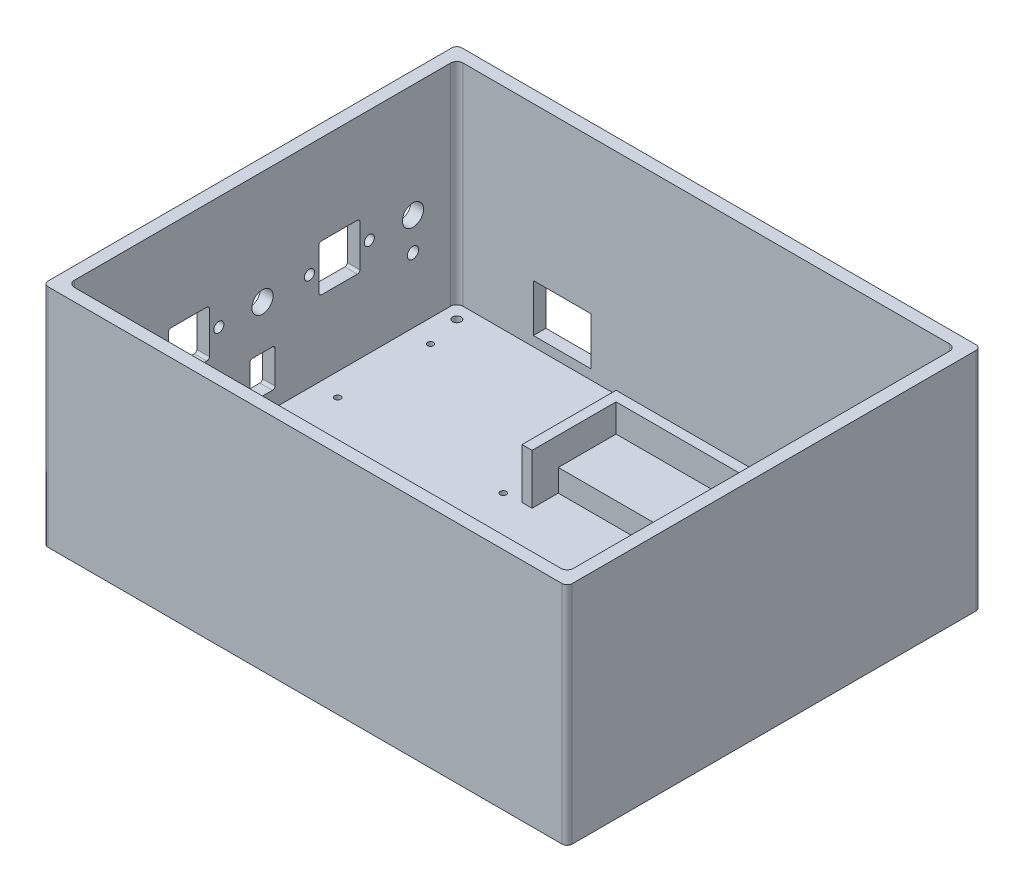
from build123d import *

# Parameters (mm, degrees)
CROQUIS1_W                                           = 209
CROQUIS1_H                                           = 165
SALIENTE_EXTRUIR1_DEPTH                              = 6
SALIENTE_EXTRUIR2_DEPTH                              = 20
CROQUIS5_W                                           = 110
CROQUIS5_H                                           = 23.048861143
SALIENTE_EXTRUIR3_DEPTH                              = 8.865038464
CROQUIS6_W                                           = 209
CROQUIS6_H                                           = 165
CROQUIS6_W_2                                         = 199
CROQUIS6_H_2                                         = 155
SALIENTE_EXTRUIR4_DEPTH                              = 84
CORTAR_EXTRUIR2_REACH                                = 359.208
CROQUIS8_W                                           = 23
CROQUIS8_H                                           = 19
CORTAR_EXTRUIR4_REACH                                = 254.595
CROQUIS10_R                                          = 1.25
CROQUIS10_W                                          = 10
CROQUIS10_H                                          = 15
CROQUIS9_R                                           = 2
CROQUIS9_W                                           = 16.35
CROQUIS9_H                                           = 18.6
CORTAR_EXTRUIR5_DEPTH                                = 10
AVELLANADO_PARA_TORNILLO_CON_CABEZA_PLAN_D           = 2.4
AVELLANADO_PARA_TORNILLO_CON_CABEZA_PLAN_CSINK_D     = 4.4
AVELLANADO_PARA_TORNILLO_CON_CABEZA_PLAN_CSINK_ANGLE = 90
REDONDEO1_R                                          = 2
REDONDEO2_R                                          = 2.5
MATRIZL2_COUNT                                       = 2
MATRIZL2_PITCH                                       = 60
MATRIZL3_COUNT                                       = 2
MATRIZL3_PITCH                                       = 60
CORTAR_EXTRUIR6_DEPTH                                = 10
REFRENTADO_PARA_TORNILLO_TAP_N_CON_CABEZ_D           = 3.4
REFRENTADO_PARA_TORNILLO_TAP_N_CON_CABEZ_DEPTH       = 8.2
REFRENTADO_PARA_TORNILLO_TAP_N_CON_CABEZ_CSINK_D     = 6.72
REFRENTADO_PARA_TORNILLO_TAP_N_CON_CABEZ_CSINK_ANGLE = 90
REFRENTADO_PARA_TORNILLO_TAP_N_CON_CABEZ_TIP         = 1.021463052
CORTAR_EXTRUIR7_REACH                                = 254.595
CROQUIS24_R                                          = 2.25
REDONDEO3_R                                          = 1


with BuildPart() as part:
    # Croquis1 → Saliente-Extruir1 (new body)
    with BuildSketch(Plane(origin=(40.752081892, -109.4, 0), x_dir=(-1, 0, 0), z_dir=(0, -1, 0))):
        with Locations((-149.8, 0)):
            Rectangle(CROQUIS1_W, CROQUIS1_H)
    extrude(amount=SALIENTE_EXTRUIR1_DEPTH)

    # Croquis3 → Saliente-Extruir2 (add)
    with BuildSketch(Plane(origin=(0, -109.4, 0), x_dir=(1, 0, 0), z_dir=(0, 1, 0))):
        Polygon((177.052081892, -55), (177.052081892, -21.5), (173.052081892, -21.5), (173.052081892, -59), (291.052081892, -59), (291.052081892, 59), (173.052081892, 59), (173.052081892, 21.5), (177.052081892, 21.5), (177.052081892, 55), (287.052081892, 55), (287.052081892, -55), align=None)
    extrude(amount=SALIENTE_EXTRUIR2_DEPTH)

    # Croquis5 → Saliente-Extruir3 (add)
    with BuildSketch(Plane(origin=(0, -109.4, 0), x_dir=(1, 0, 0), z_dir=(0, 1, 0))):
        with Locations((232.052081892, 43.475569429)):
            Rectangle(CROQUIS5_W, CROQUIS5_H)
        with Locations((232.052081892, -43.475569429)):
            Rectangle(CROQUIS5_W, CROQUIS5_H)
    extrude(amount=SALIENTE_EXTRUIR3_DEPTH)

    # Croquis6 → Saliente-Extruir4 (add)
    with BuildSketch(Plane(origin=(0, -109.4, 0), x_dir=(1, 0, 0), z_dir=(0, 1, 0))):
        with Locations((190.552081892, 0)):
            Rectangle(CROQUIS6_W, CROQUIS6_H)
        with Locations((190.552081892, 0)):
            Rectangle(CROQUIS6_W_2, CROQUIS6_H_2, mode=Mode.SUBTRACT)
    extrude(amount=SALIENTE_EXTRUIR4_DEPTH)

    # Croquis8 → Cortar-Extruir2 (cut, up to next)
    with BuildSketch(Plane(origin=(0, 0, -82.5), x_dir=(-1, 0, 0), z_dir=(0, 0, -1)), mode=Mode.PRIVATE) as cortar_extruir2_sk1:
        with Locations((-133.052081892, -96)):
            Rectangle(CROQUIS8_W, CROQUIS8_H)
    cortar_extruir2_tool1 = extrude(cortar_extruir2_sk1.sketch, amount=-CORTAR_EXTRUIR2_REACH, mode=Mode.PRIVATE) & part.part
    add(cortar_extruir2_tool1.solids().sort_by_distance((133.052082, -96, -82.5))[0], mode=Mode.SUBTRACT)

    # Croquis10 → Cortar-Extruir4 (cut, up to next)
    with BuildSketch(Plane.ZY.offset(-86.052081892), mode=Mode.PRIVATE) as cortar_extruir4_sk1:
        with Locations((0, -70.4)):
            Circle(CROQUIS10_R)
    cortar_extruir4_tool1 = extrude(cortar_extruir4_sk1.sketch, amount=-CORTAR_EXTRUIR4_REACH, mode=Mode.PRIVATE) & part.part
    # Croquis10 → Cortar-Extruir4 (cut, up to next)
    with BuildSketch(Plane.ZY.offset(-86.052081892), mode=Mode.PRIVATE) as cortar_extruir4_sk2:
        with Locations((0, -95.4)):
            Rectangle(CROQUIS10_W, CROQUIS10_H)
    cortar_extruir4_tool2 = extrude(cortar_extruir4_sk2.sketch, amount=-CORTAR_EXTRUIR4_REACH, mode=Mode.PRIVATE) & part.part
    add(cortar_extruir4_tool1.solids().sort_by_distance((86.052082, -70.4, 0))[0], mode=Mode.SUBTRACT)
    add(cortar_extruir4_tool2.solids().sort_by_distance((86.052082, -95.4, 0))[0], mode=Mode.SUBTRACT)

    # Croquis9 → Cortar-Extruir5 (cut)
    with BuildSketch(Plane(origin=(86.052081892, 0, 168.552081892), x_dir=(0, 0, -1), z_dir=(1, 0, 0))):
        with Locations((187.302081892, -70.4)):
            Circle(CROQUIS9_R)
        with Locations((211.152081892, -70.4)):
            Circle(CROQUIS9_R)
        with Locations((199.227081892, -70.4)):
            Rectangle(CROQUIS9_W, CROQUIS9_H)
    cortar_extruir5 = extrude(amount=CORTAR_EXTRUIR5_DEPTH, mode=Mode.SUBTRACT)

    # Croquis14 → Taladro de margen para 5/161 (revolve, cut)
    with BuildSketch(Plane(origin=(86.052081892, -70.4, 0), x_dir=(0, 0, 1), z_dir=(0, 1, 0))):
        Polygon((0, 0), (0, 23.733468714), (4.2164, 21.2), (4.2164, 0), align=None)
    taladro_de_margen_para_5_161 = revolve(axis=Axis((79.702081892, -70.4, 0), (1, 0, 0)), mode=Mode.SUBTRACT)

    # Avellanado para tornillo con cabeza plana de M21 (through all)
    with Locations(Plane(origin=(0, -115.4, 0), x_dir=(-1, 0, 0), z_dir=(0, -1, 0))):
        with Locations((-166.052081892, 58), (-166.052081892, 21), (-100.052081892, 21), (-100.052081892, 58)):
            CounterSinkHole(AVELLANADO_PARA_TORNILLO_CON_CABEZA_PLAN_D / 2, AVELLANADO_PARA_TORNILLO_CON_CABEZA_PLAN_CSINK_D / 2, counter_sink_angle=AVELLANADO_PARA_TORNILLO_CON_CABEZA_PLAN_CSINK_ANGLE)

    # Redondeo1
    redondeo1_edges = [part.edges().sort_by_distance(p)[0] for p in [
        (86.052081892, -70.4, 82.5),
        (295.052081892, -70.4, 82.5),
        (295.052081892, -70.4, -82.5),
        (86.052081892, -70.4, -82.5),
    ]]
    fillet(redondeo1_edges, radius=REDONDEO1_R)

    # Redondeo2
    redondeo2_edges = [part.edges().sort_by_distance(p)[0] for p in [
        (290.052081892, -67.4, -77.5),
        (91.052081892, -67.4, -77.5),
        (91.052081892, -67.4, 77.5),
        (290.052081892, -67.4, 77.5),
    ]]
    fillet(redondeo2_edges, radius=REDONDEO2_R)

    # MatrizL2: Taladro de margen para 5/161 ×2
    with Locations(*[(0, 0, -i * MATRIZL2_PITCH) for i in range(1, MATRIZL2_COUNT)]):
        add(taladro_de_margen_para_5_161, mode=Mode.SUBTRACT)

    # MatrizL3: Cortar-Extruir5 ×2
    with Locations(*[(0, 0, i * MATRIZL3_PITCH) for i in range(1, MATRIZL3_COUNT)]):
        add(cortar_extruir5, mode=Mode.SUBTRACT)

    # Croquis20 → Cortar-Extruir6 (cut)
    with BuildSketch(Plane.ZY.offset(-86.052081892)):
        with BuildLine():
            Line((51.75, -73.4), (51.75, -67.4))
            ThreePointArc((51.75, -67.4), (55.5, -63.65), (59.25, -67.4))
            Line((59.25, -67.4), (59.25, -73.4))
            ThreePointArc((59.25, -73.4), (55.5, -77.15), (51.75, -73.4))
        make_face()
    extrude(amount=-CORTAR_EXTRUIR6_DEPTH, mode=Mode.SUBTRACT)

    # Refrentado para tornillo tapón con cabeza plana de clavija de M31
    with Locations(Plane(origin=(0, -115.4, 0), x_dir=(-1, 0, 0), z_dir=(0, -1, 0))):
        with Locations((-284.302081892, 71.75), (-284.302081892, -71.75), (-96.802081892, -71.75), (-96.802081892, 71.75)):
            CounterSinkHole(REFRENTADO_PARA_TORNILLO_TAP_N_CON_CABEZ_D / 2, REFRENTADO_PARA_TORNILLO_TAP_N_CON_CABEZ_CSINK_D / 2, depth=REFRENTADO_PARA_TORNILLO_TAP_N_CON_CABEZ_DEPTH, counter_sink_angle=REFRENTADO_PARA_TORNILLO_TAP_N_CON_CABEZ_CSINK_ANGLE)
            with Locations((0, 0, -(REFRENTADO_PARA_TORNILLO_TAP_N_CON_CABEZ_DEPTH + REFRENTADO_PARA_TORNILLO_TAP_N_CON_CABEZ_TIP / 2))):  # 118° drill point
                Cone(0, REFRENTADO_PARA_TORNILLO_TAP_N_CON_CABEZ_D / 2, REFRENTADO_PARA_TORNILLO_TAP_N_CON_CABEZ_TIP, mode=Mode.SUBTRACT)

    # Croquis24 → Cortar-Extruir7 (cut, up to next)
    with BuildSketch(Plane.ZY.offset(-86.052081892), mode=Mode.PRIVATE) as cortar_extruir7_sk1:
        with Locations((-60, -83.4)):
            Circle(CROQUIS24_R)
    cortar_extruir7_tool1 = extrude(cortar_extruir7_sk1.sketch, amount=-CORTAR_EXTRUIR7_REACH, mode=Mode.PRIVATE) & part.part
    add(cortar_extruir7_tool1.solids().sort_by_distance((86.052082, -83.4, -60))[0], mode=Mode.SUBTRACT)

    # Redondeo3
    redondeo3_edges = [part.edges().sort_by_distance(p)[0] for p in [
        (88.552081892, -87.9, 5),
        (88.552081892, -102.9, 5),
        (88.552081892, -102.9, -5),
        (88.552081892, -87.9, -5),
        (88.552081892, -79.7, -38.85),
        (88.552081892, -61.1, -38.85),
        (88.552081892, -61.1, -22.5),
        (88.552081892, -79.7, -22.5),
        (88.552081892, -79.7, 21.15),
        (88.552081892, -61.1, 21.15),
        (88.552081892, -61.1, 37.5),
        (88.552081892, -79.7, 37.5),
    ]]
    fillet(redondeo3_edges, radius=REDONDEO3_R)


solid = part.part
